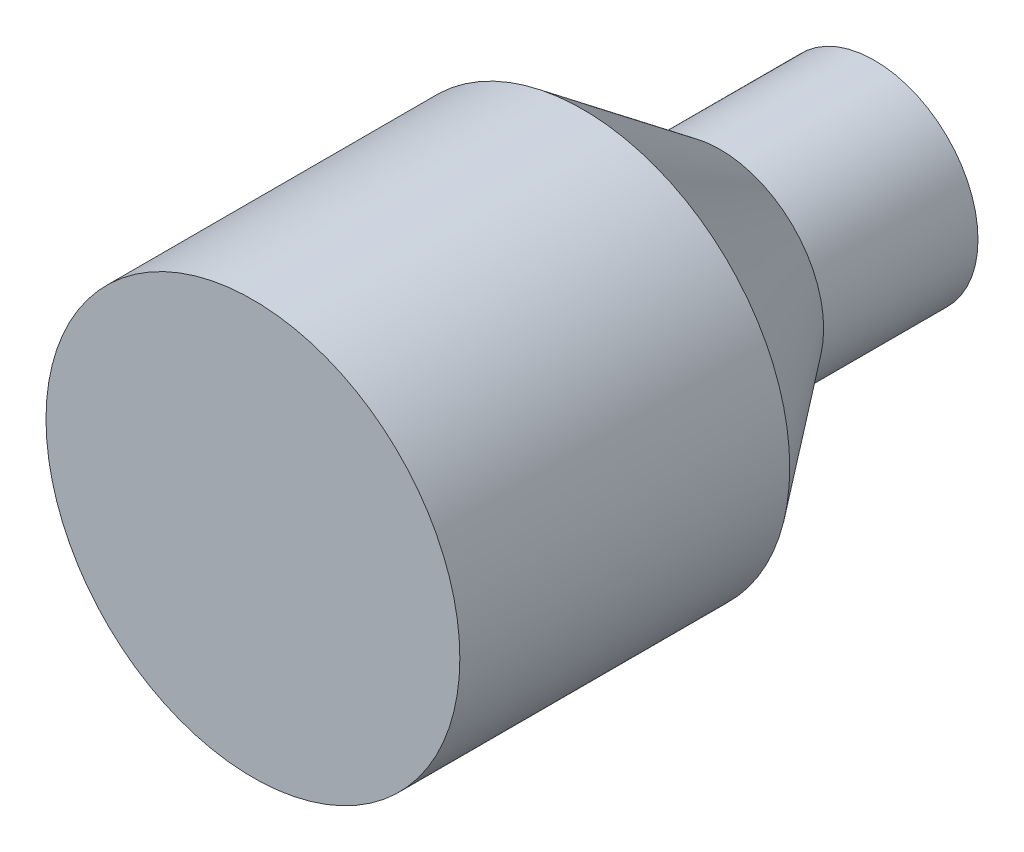
from build123d import *


with BuildPart() as part:
    # Sketch1 → Revolve1 (revolve)
    with BuildSketch(Plane(origin=(0, 0, 0), x_dir=(1, 0, 0), z_dir=(0, 1, 0))):
        Polygon((0, 0), (33.626006644, 0), (33.626006644, 53.608674526), (16.813003322, 75.934137953), (16.813003322, 101.015831434), (0, 101.015831434), align=None)
    revolve(axis=Axis((0, 0, 0), (0, 0, -1)))


solid = part.part
